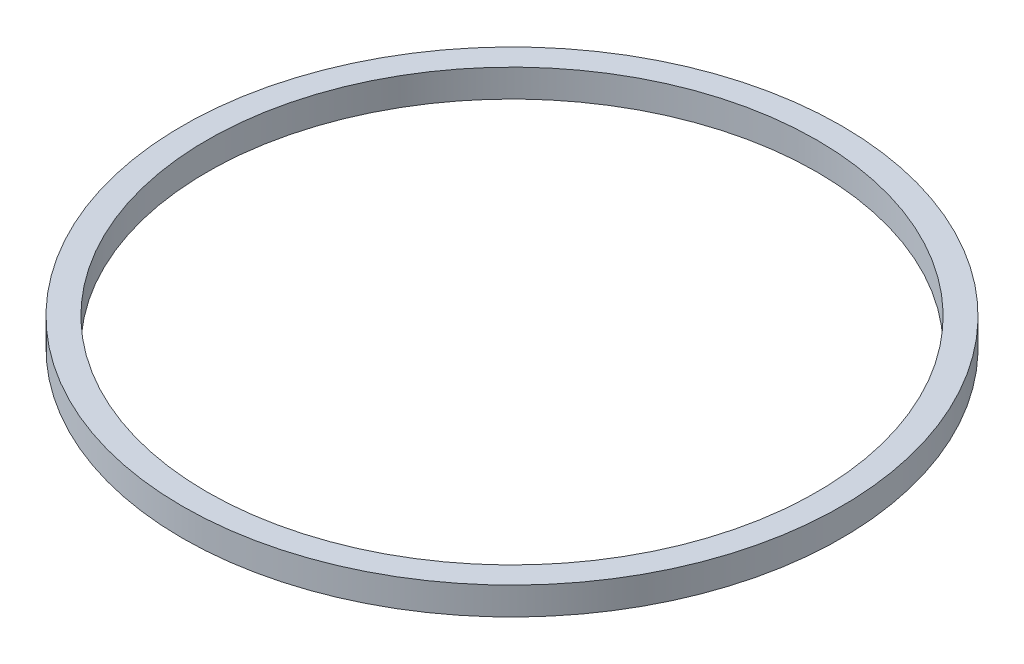
from build123d import *

# Parameters (mm, degrees)
SKETCH1_R           = 227
SKETCH1_R_2         = 210
BOSS_EXTRUDE1_DEPTH = 19.05


with BuildPart() as part:
    # Sketch1 → Boss-Extrude1 (new body)
    with BuildSketch(Plane(origin=(0, 0, 0), x_dir=(1, 0, 0), z_dir=(0, 1, 0))):
        with Locations(Location((0, 0, 0), (0, 0, 90))):
            Circle(SKETCH1_R)
        with Locations(Location((0, 0, 0), (0, 0, 90))):
            Circle(SKETCH1_R_2, mode=Mode.SUBTRACT)
    extrude(amount=BOSS_EXTRUDE1_DEPTH)


solid = part.part
